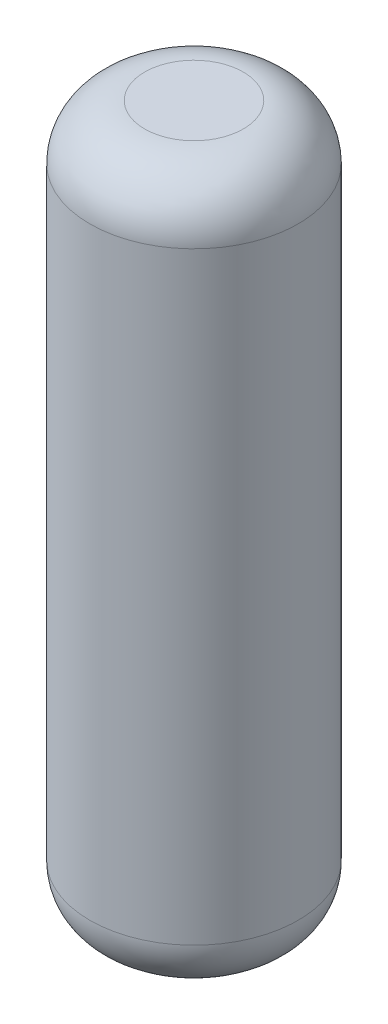
from build123d import *

# Parameters (mm, degrees)
SKETCH1_R           = 48.26
BOSS_EXTRUDE1_DEPTH = 330.2
FILLET1_R           = 25.4


with BuildPart() as part:
    # Sketch1 → Boss-Extrude1 (new body)
    with BuildSketch(Plane(origin=(0, 0, 0), x_dir=(1, 0, 0), z_dir=(0, 1, 0))):
        with Locations(Location((0, 0, 0), (0, 0, 270))):
            Circle(SKETCH1_R)
    extrude(amount=BOSS_EXTRUDE1_DEPTH)

    # Fillet1
    fillet1_edges = [part.edges().sort_by_distance(p)[0] for p in [
        (0, 0, -48.26),
        (0, 330.2, -48.26),
    ]]
    fillet(fillet1_edges, radius=FILLET1_R)


solid = part.part
